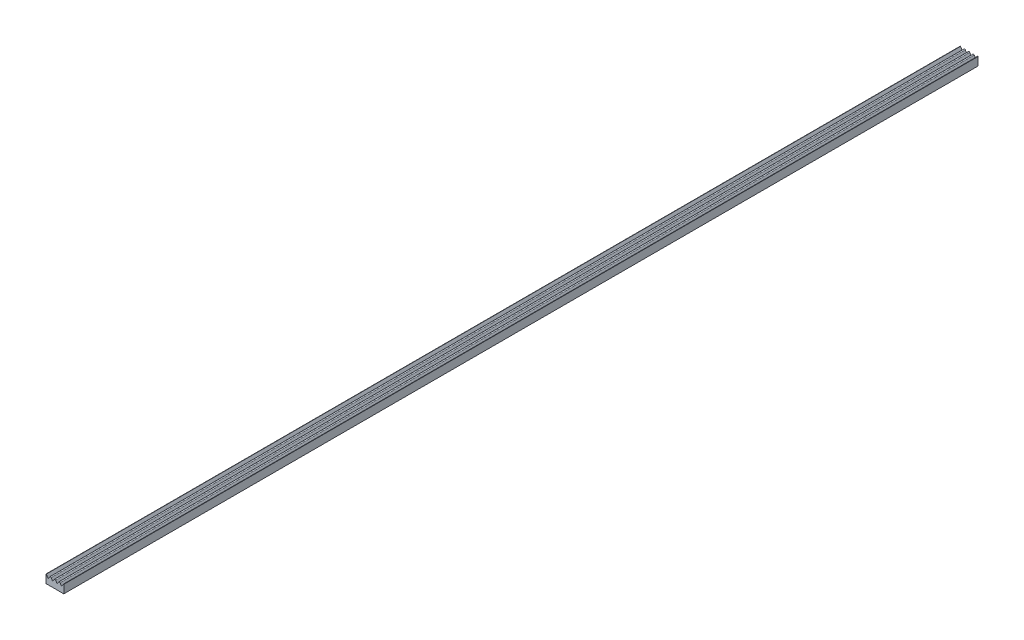
from build123d import *

# Parameters (mm, degrees)
BOSS_EXTRUDE1_DEPTH = 652.145


with BuildPart() as part:
    # Sketch1 → Boss-Extrude1 (new body)
    with BuildSketch(Plane.XY):
        with BuildLine():
            Line((0, 0), (-12.7, 0))
            Line((-12.7, 0), (-12.7, 5.907176879))
            ThreePointArc((-12.7, 5.907176879), (-12.608011679, 6.02925547), (-12.465304215, 5.974486745))
            Line((-12.465304215, 5.974486745), (-11.1125, 3.81))
            Line((-11.1125, 3.81), (-10.063478923, 5.488433723))
            ThreePointArc((-10.063478923, 5.488433723), (-9.525, 5.786884396), (-8.986521077, 5.488433723))
            Line((-8.986521077, 5.488433723), (-7.9375, 3.81))
            Line((-7.9375, 3.81), (-6.888478923, 5.488433723))
            ThreePointArc((-6.888478923, 5.488433723), (-6.35, 5.786884396), (-5.811521077, 5.488433723))
            Line((-5.811521077, 5.488433723), (-4.7625, 3.81))
            Line((-4.7625, 3.81), (-3.713478923, 5.488433723))
            ThreePointArc((-3.713478923, 5.488433723), (-3.175, 5.786884396), (-2.636521077, 5.488433723))
            Line((-2.636521077, 5.488433723), (-1.5875, 3.81))
            Line((-1.5875, 3.81), (-0.234695785, 5.974486745))
            ThreePointArc((-0.234695785, 5.974486745), (-0.091988321, 6.02925547), (0, 5.907176879))
            Line((0, 5.907176879), (0, 0))
        make_face()
    extrude(amount=BOSS_EXTRUDE1_DEPTH)


solid = part.part
